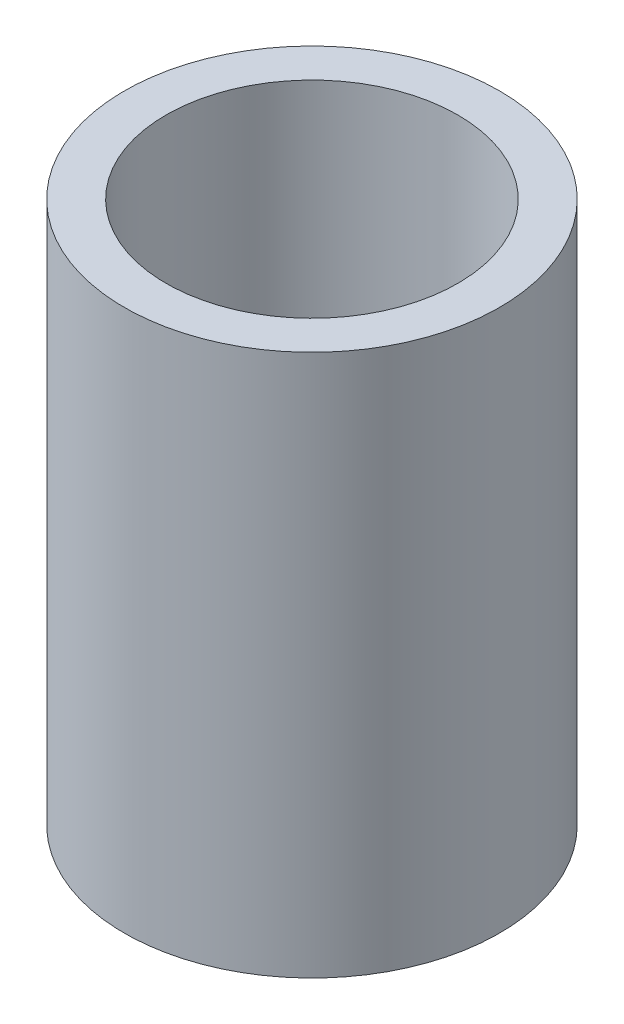
from build123d import *

# Parameters (mm, degrees)
SKETCH1_R           = 4.5
SKETCH1_R_2         = 3.5
BOSS_EXTRUDE1_DEPTH = 13


with BuildPart() as part:
    # Sketch1 → Boss-Extrude1 (new body)
    with BuildSketch(Plane(origin=(0, 0, 0), x_dir=(1, 0, 0), z_dir=(0, 1, 0))):
        with Locations(Location((0, 0, 0), (0, 0, 90))):
            Circle(SKETCH1_R)
        with Locations(Location((0, 0, 0), (0, 0, 90))):
            Circle(SKETCH1_R_2, mode=Mode.SUBTRACT)
    extrude(amount=BOSS_EXTRUDE1_DEPTH)


solid = part.part
